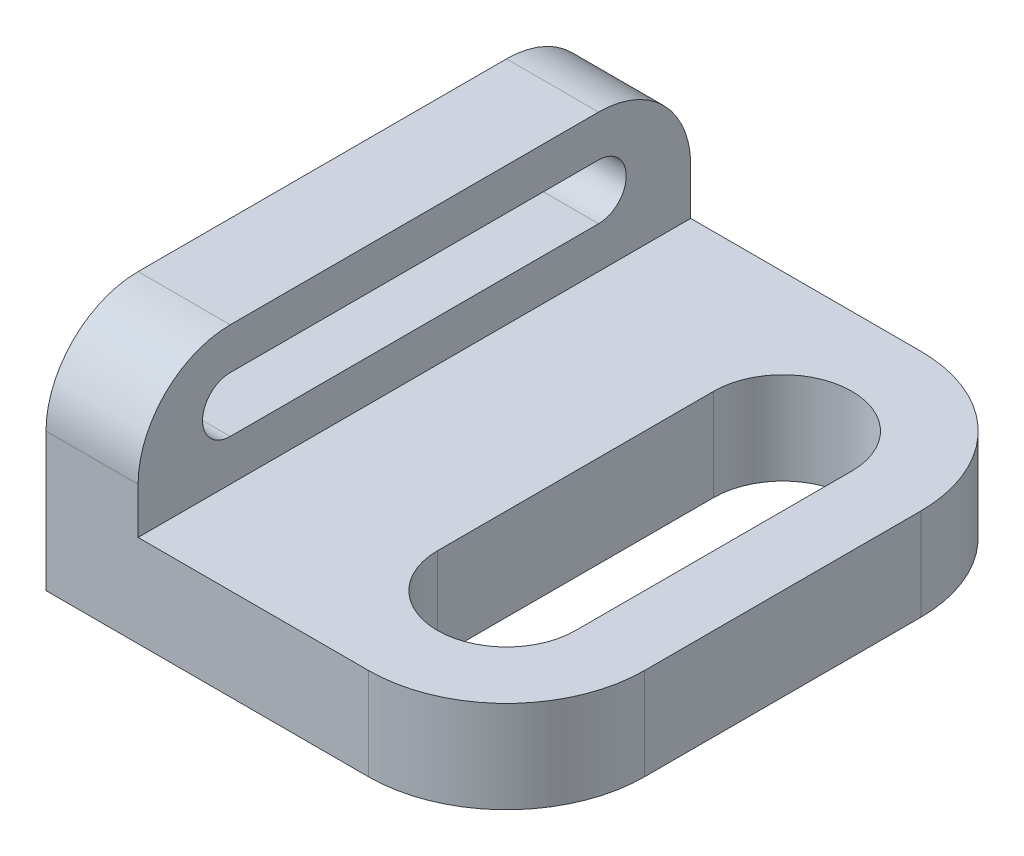
from build123d import *

# Parameters (mm, degrees)
BOSS_EXTRUDE1_DEPTH = 20
SKETCH2_W           = 20
SKETCH2_H           = 120
BOSS_EXTRUDE2_DEPTH = 30
CUT_EXTRUDE1_DEPTH  = 20


with BuildPart() as part:
    # Sketch1 → Boss-Extrude1 (new body)
    with BuildSketch(Plane(origin=(0, 0, 0), x_dir=(1, 0, 0), z_dir=(0, 1, 0))):
        with BuildLine():
            Line((-50, 60), (20, 60))
            ThreePointArc((20, 60), (41.213203436, 51.213203436), (50, 30))
            Line((50, 30), (50, -30))
            ThreePointArc((50, -30), (41.213203436, -51.213203436), (20, -60))
            Line((20, -60), (-50, -60))
            Line((-50, -60), (-50, 60))
        make_face()
        with BuildLine():
            Line((35, 30), (35, -30))
            ThreePointArc((35, -30), (20, -45), (5, -30))
            Line((5, -30), (5, 30))
            ThreePointArc((5, 30), (20, 45), (35, 30))
        make_face(mode=Mode.SUBTRACT)
    extrude(amount=BOSS_EXTRUDE1_DEPTH)

    # Sketch2 → Boss-Extrude2 (add)
    with BuildSketch(Plane(origin=(0, 20, 0), x_dir=(1, 0, 0), z_dir=(0, 1, 0))):
        with Locations((-40, 0)):
            Rectangle(SKETCH2_W, SKETCH2_H)
    extrude(amount=BOSS_EXTRUDE2_DEPTH)

    # Sketch3 → Cut-Extrude1 (cut)
    with BuildSketch(Plane(origin=(-30, 0, 0), x_dir=(0, 0, -1), z_dir=(1, 0, 0))):
        with BuildLine():
            Line((-40, 50), (-60, 50))
            Line((-60, 50), (-60, 30))
            ThreePointArc((-60, 30), (-54.142135624, 44.142135624), (-40, 50))
        make_face()
        with BuildLine():
            Line((40, 50), (60, 50))
            Line((60, 50), (60, 30))
            ThreePointArc((60, 30), (54.142135624, 44.142135624), (40, 50))
        make_face()
        with BuildLine():
            Line((-40, 41), (40, 41))
            ThreePointArc((40, 41), (46, 35), (40, 29))
            Line((40, 29), (-40, 29))
            ThreePointArc((-40, 29), (-46, 35), (-40, 41))
        make_face()
    extrude(amount=-CUT_EXTRUDE1_DEPTH, mode=Mode.SUBTRACT)


solid = part.part
